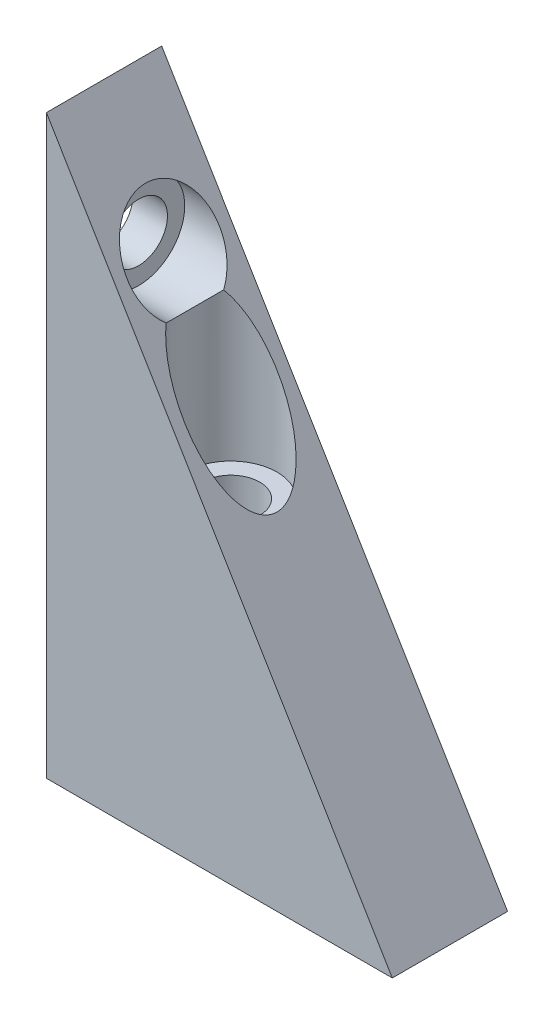
from build123d import *

# Parameters (mm, degrees)
EXTRUDE_1_DEPTH     = 10
SKETCH_2_R          = 2.5
CUT_EXTRUDE_1_DEPTH = 60.160797831
SKETCH_3_R          = 2.5
CUT_EXTRUDE_2_DEPTH = 60.160797831
SKETCH_4_R          = 4
CUT_EXTRUDE_3_DEPTH = 26
SKETCH_5_R          = 4
CUT_EXTRUDE_4_DEPTH = 27


with BuildPart() as part:
    # 草图1 → 凸台-拉伸1 (new body)
    with BuildSketch(Plane.XY):
        Polygon((0, 0), (0, 50), (30, 0), align=None)
    extrude(amount=EXTRUDE_1_DEPTH)

    # 草图2 → 切除-拉伸1 (cut, through all)
    with BuildSketch(Plane.XZ):
        with Locations(Location((11, 5, 0), (0, 0, 270))):
            Circle(SKETCH_2_R)
    extrude(amount=-CUT_EXTRUDE_1_DEPTH, mode=Mode.SUBTRACT)

    # 草图3 → 切除-拉伸2 (cut, through all)
    with BuildSketch(Plane.ZY):
        with Locations((5, 40)):
            Circle(SKETCH_3_R)
    extrude(amount=-CUT_EXTRUDE_2_DEPTH, mode=Mode.SUBTRACT)

    # 草图4 → 切除-拉伸3 (cut)
    with BuildSketch(Plane(origin=(0, 50, 0), x_dir=(-1, 0, 0), z_dir=(0, -1, 0))):
        with Locations(Location((-11, -5, 0), (0, 0, 339.715190562))):
            Circle(SKETCH_4_R)
    extrude(amount=CUT_EXTRUDE_3_DEPTH, mode=Mode.SUBTRACT)

    # 草图5 → 切除-拉伸4 (cut)
    with BuildSketch(Plane.ZY.offset(-30)):
        with Locations(Location((5, 40, 0), (0, 0, 231.375167127))):
            Circle(SKETCH_5_R)
    extrude(amount=CUT_EXTRUDE_4_DEPTH, mode=Mode.SUBTRACT)


solid = part.part
